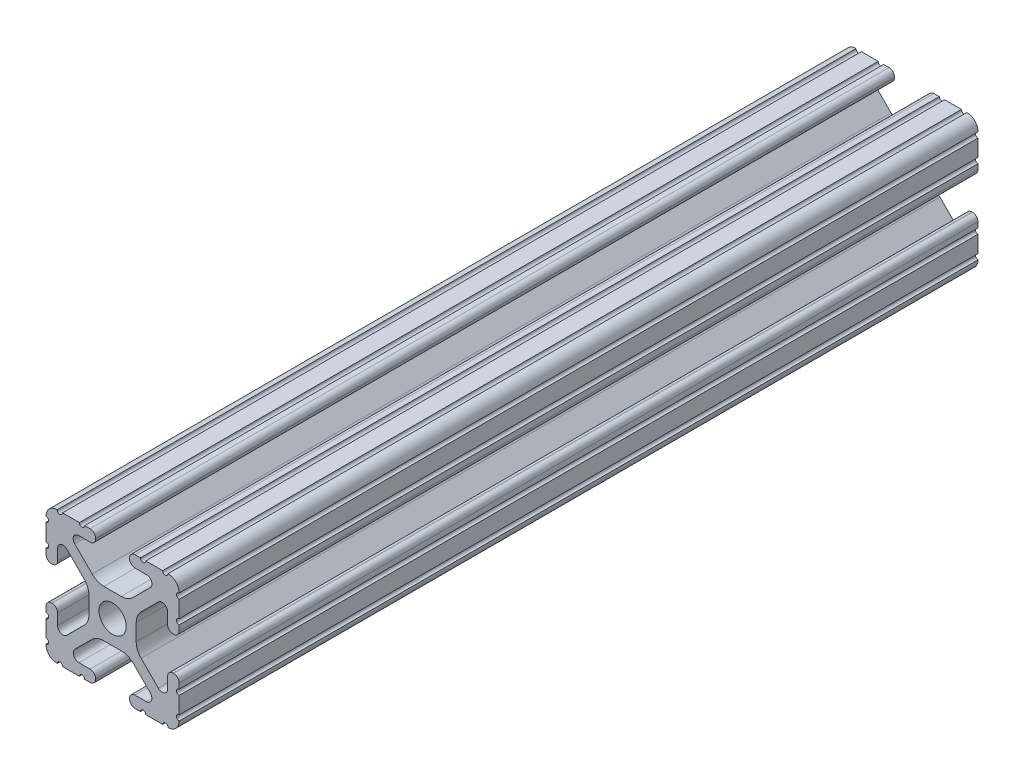
from build123d import *

# Parameters (mm, degrees)
SKETCH1_R      = 2.6035
EXTRUDE1_DEPTH = 152.4


with BuildPart() as part:
    # Sketch1 → Extrude1 (new body)
    with BuildSketch(Plane.XY):
        with BuildLine():
            Line((-7.207036008, 8.724370562), (-3.898272566, 5.423169045))
            ThreePointArc((-3.898272566, 5.423169045), (-2.869120213, 4.736787962), (-1.655778399, 4.4958))
            Line((-1.655778399, 4.4958), (1.655778399, 4.4958))
            ThreePointArc((1.655778399, 4.4958), (2.869120213, 4.736787962), (3.898272566, 5.423169045))
            Line((3.898272566, 5.423169045), (7.207036008, 8.724370562))
            ThreePointArc((7.207036008, 8.724370562), (7.432222385, 9.85140422), (6.476788598, 10.4902))
            Line((6.476788598, 10.4902), (4.287512407, 10.4902))
            ThreePointArc((4.287512407, 10.4902), (3.54574862, 10.79744862), (3.2385, 11.539212407))
            Line((3.2385, 11.539212407), (3.2385, 11.650987593))
            ThreePointArc((3.2385, 11.650987593), (3.54574862, 12.39275138), (4.287512407, 12.7))
            Line((4.287512407, 12.7), (5.317126718, 12.7))
            ThreePointArc((5.317126718, 12.7), (5.825126718, 12.192), (6.333126718, 12.7))
            Line((6.333126718, 12.7), (9.550443118, 12.7))
            ThreePointArc((9.550443118, 12.7), (10.058366869, 12.192000006), (10.566443095, 12.699847501))
            ThreePointArc((10.566443095, 12.699847501), (12.082537762, 12.08250727), (12.699846982, 10.566399977))
            ThreePointArc((12.699846982, 10.566399977), (12.192000006, 10.058323491), (12.7, 9.5504))
            Line((12.7, 9.5504), (12.7, 6.3330836))
            ThreePointArc((12.7, 6.3330836), (12.192, 5.8250836), (12.7, 5.3170836))
            Line((12.7, 5.3170836), (12.7, 4.287469289))
            ThreePointArc((12.7, 4.287469289), (12.39275138, 3.545705502), (11.650987593, 3.238456882))
            Line((11.650987593, 3.238456882), (11.539212407, 3.238456882))
            ThreePointArc((11.539212407, 3.238456882), (10.79744862, 3.545705502), (10.4902, 4.287469289))
            Line((10.4902, 4.287469289), (10.4902, 6.402089023))
            ThreePointArc((10.4902, 6.402089023), (9.856505071, 7.351067942), (8.737131347, 7.129408934))
            Line((8.737131347, 7.129408934), (5.441005833, 3.840816462))
            ThreePointArc((5.441005833, 3.840816462), (4.750877967, 2.809883091), (4.5085, 1.593185507))
            Line((4.5085, 1.593185507), (4.5085, -1.593185507))
            ThreePointArc((4.5085, -1.593185507), (4.750877967, -2.809883091), (5.441005833, -3.840816462))
            Line((5.441005833, -3.840816462), (8.737131347, -7.129408934))
            ThreePointArc((8.737131347, -7.129408934), (9.856505071, -7.351067942), (10.4902, -6.402089023))
            Line((10.4902, -6.402089023), (10.4902, -4.287469289))
            ThreePointArc((10.4902, -4.287469289), (10.79744862, -3.545705502), (11.539212407, -3.238456882))
            Line((11.539212407, -3.238456882), (11.650987593, -3.238456882))
            ThreePointArc((11.650987593, -3.238456882), (12.39275138, -3.545705502), (12.7, -4.287469289))
            Line((12.7, -4.287469289), (12.7, -5.3170836))
            ThreePointArc((12.7, -5.3170836), (12.192, -5.8250836), (12.7, -6.3330836))
            Line((12.7, -6.3330836), (12.7, -9.5504))
            ThreePointArc((12.7, -9.5504), (12.192000006, -10.058323491), (12.699846982, -10.566399977))
            ThreePointArc((12.699846982, -10.566399977), (12.082537762, -12.08250727), (10.566443095, -12.699847501))
            ThreePointArc((10.566443095, -12.699847501), (10.058366869, -12.192000006), (9.550443118, -12.7))
            Line((9.550443118, -12.7), (6.333126718, -12.7))
            ThreePointArc((6.333126718, -12.7), (5.825126718, -12.192), (5.317126718, -12.7))
            Line((5.317126718, -12.7), (4.287512407, -12.7))
            ThreePointArc((4.287512407, -12.7), (3.54574862, -12.39275138), (3.2385, -11.650987593))
            Line((3.2385, -11.650987593), (3.2385, -11.539212407))
            ThreePointArc((3.2385, -11.539212407), (3.54574862, -10.79744862), (4.287512407, -10.4902))
            Line((4.287512407, -10.4902), (6.416408329, -10.4902))
            ThreePointArc((6.416408329, -10.4902), (7.41473083, -9.822813117), (7.179650497, -8.645192506))
            Line((7.179650497, -8.645192506), (3.952270251, -5.423690499))
            ThreePointArc((3.952270251, -5.423690499), (2.922936451, -4.736929036), (1.709253557, -4.4958))
            Line((1.709253557, -4.4958), (-1.709253557, -4.4958))
            ThreePointArc((-1.709253557, -4.4958), (-2.922936451, -4.736929036), (-3.952270251, -5.423690499))
            Line((-3.952270251, -5.423690499), (-7.179650497, -8.645192506))
            ThreePointArc((-7.179650497, -8.645192506), (-7.41473083, -9.822813117), (-6.416408329, -10.4902))
            Line((-6.416408329, -10.4902), (-4.287512407, -10.4902))
            ThreePointArc((-4.287512407, -10.4902), (-3.54574862, -10.79744862), (-3.2385, -11.539212407))
            Line((-3.2385, -11.539212407), (-3.2385, -11.650987593))
            ThreePointArc((-3.2385, -11.650987593), (-3.54574862, -12.39275138), (-4.287512407, -12.7))
            Line((-4.287512407, -12.7), (-5.317126718, -12.7))
            ThreePointArc((-5.317126718, -12.7), (-5.825126718, -12.192), (-6.333126718, -12.7))
            Line((-6.333126718, -12.7), (-9.550443118, -12.7))
            ThreePointArc((-9.550443118, -12.7), (-10.058366869, -12.192000006), (-10.566443095, -12.699847501))
            ThreePointArc((-10.566443095, -12.699847501), (-12.082537762, -12.08250727), (-12.699846982, -10.566399977))
            ThreePointArc((-12.699846982, -10.566399977), (-12.192000006, -10.058323491), (-12.7, -9.5504))
            Line((-12.7, -9.5504), (-12.7, -6.3330836))
            ThreePointArc((-12.7, -6.3330836), (-12.192, -5.8250836), (-12.7, -5.3170836))
            Line((-12.7, -5.3170836), (-12.7, -4.287469289))
            ThreePointArc((-12.7, -4.287469289), (-12.39275138, -3.545705502), (-11.650987593, -3.238456882))
            Line((-11.650987593, -3.238456882), (-11.539212407, -3.238456882))
            ThreePointArc((-11.539212407, -3.238456882), (-10.79744862, -3.545705502), (-10.4902, -4.287469289))
            Line((-10.4902, -4.287469289), (-10.4902, -6.402089023))
            ThreePointArc((-10.4902, -6.402089023), (-9.856505071, -7.351067942), (-8.737131347, -7.129408934))
            Line((-8.737131347, -7.129408934), (-5.441005833, -3.840816462))
            ThreePointArc((-5.441005833, -3.840816462), (-4.750877967, -2.809883091), (-4.5085, -1.593185507))
            Line((-4.5085, -1.593185507), (-4.5085, 1.593185507))
            ThreePointArc((-4.5085, 1.593185507), (-4.750877967, 2.809883091), (-5.441005833, 3.840816462))
            Line((-5.441005833, 3.840816462), (-8.737131347, 7.129408934))
            ThreePointArc((-8.737131347, 7.129408934), (-9.856505071, 7.351067942), (-10.4902, 6.402089023))
            Line((-10.4902, 6.402089023), (-10.4902, 4.287469289))
            ThreePointArc((-10.4902, 4.287469289), (-10.79744862, 3.545705502), (-11.539212407, 3.238456882))
            Line((-11.539212407, 3.238456882), (-11.650987593, 3.238456882))
            ThreePointArc((-11.650987593, 3.238456882), (-12.39275138, 3.545705502), (-12.7, 4.287469289))
            Line((-12.7, 4.287469289), (-12.7, 5.3170836))
            ThreePointArc((-12.7, 5.3170836), (-12.192, 5.8250836), (-12.7, 6.3330836))
            Line((-12.7, 6.3330836), (-12.7, 9.5504))
            ThreePointArc((-12.7, 9.5504), (-12.192000006, 10.058323491), (-12.699846982, 10.566399977))
            ThreePointArc((-12.699846982, 10.566399977), (-12.082537762, 12.08250727), (-10.566443095, 12.699847501))
            ThreePointArc((-10.566443095, 12.699847501), (-10.058366869, 12.192000006), (-9.550443118, 12.7))
            Line((-9.550443118, 12.7), (-6.333126718, 12.7))
            ThreePointArc((-6.333126718, 12.7), (-5.825126718, 12.192), (-5.317126718, 12.7))
            Line((-5.317126718, 12.7), (-4.287512407, 12.7))
            ThreePointArc((-4.287512407, 12.7), (-3.54574862, 12.39275138), (-3.2385, 11.650987593))
            Line((-3.2385, 11.650987593), (-3.2385, 11.539212407))
            ThreePointArc((-3.2385, 11.539212407), (-3.54574862, 10.79744862), (-4.287512407, 10.4902))
            Line((-4.287512407, 10.4902), (-6.476788598, 10.4902))
            ThreePointArc((-6.476788598, 10.4902), (-7.432222385, 9.85140422), (-7.207036008, 8.724370562))
        make_face()
        Circle(SKETCH1_R, mode=Mode.SUBTRACT)
    extrude(amount=-EXTRUDE1_DEPTH)


solid = part.part
